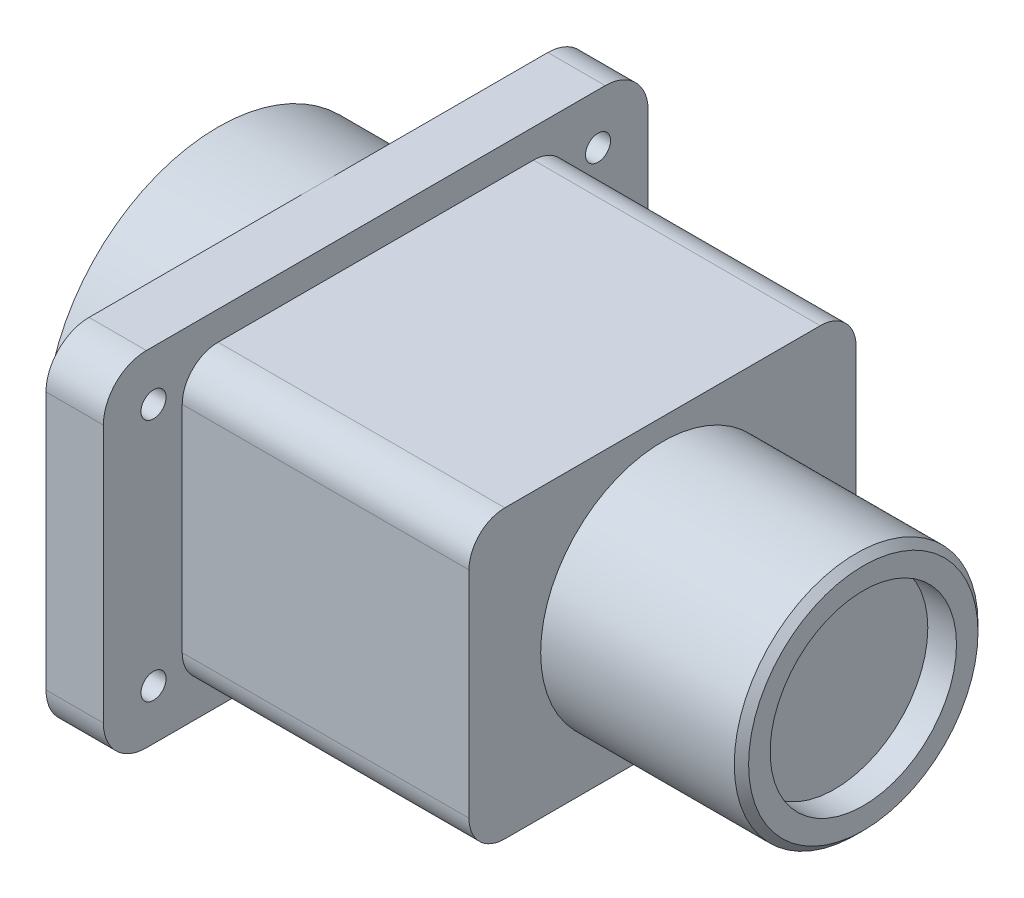
from build123d import *

# Parameters (mm, degrees)
ESQUISSE1_R             = 24
BOSS_EXTRU_1_DEPTH      = 14
BOSS_EXTRU_2_DEPTH      = 8
ESQUISSE3_R             = 1.75
ENL_V_MAT_EXTRU_1_DEPTH = 8
BOSS_EXTRU_3_DEPTH      = 40
ESQUISSE5_R             = 17
BOSS_EXTRU_4_DEPTH      = 28
ESQUISSE6_R             = 13
ENL_V_MAT_EXTRU_2_DEPTH = 4
CHANFREIN1_SIZE         = 1


with BuildPart() as part:
    # Esquisse1 → Boss.-Extru.1 (new body)
    with BuildSketch(Plane(origin=(0, 0, 0), x_dir=(0, 0, -1), z_dir=(1, 0, 0))):
        Circle(ESQUISSE1_R)
    extrude(amount=BOSS_EXTRU_1_DEPTH)

    # Esquisse2 → Boss.-Extru.2 (add)
    with BuildSketch(Plane(origin=(14, 0, 0), x_dir=(0, 0, -1), z_dir=(1, 0, 0))):
        with BuildLine():
            Line((-32, -24), (32, -24))
            ThreePointArc((32, -24), (36.242640687, -22.242640687), (38, -18))
            Line((38, -18), (38, 18))
            ThreePointArc((38, 18), (36.242640687, 22.242640687), (32, 24))
            Line((32, 24), (-32, 24))
            ThreePointArc((-32, 24), (-36.242640687, 22.242640687), (-38, 18))
            Line((-38, 18), (-38, -18))
            ThreePointArc((-38, -18), (-36.242640687, -22.242640687), (-32, -24))
        make_face()
    extrude(amount=BOSS_EXTRU_2_DEPTH)

    # Esquisse3 → Enlèv. mat.-Extru.1 (cut)
    with BuildSketch(Plane(origin=(22, 0, 0), x_dir=(0, 0, -1), z_dir=(1, 0, 0))):
        with Locations((31, 17)):
            Circle(ESQUISSE3_R)
        with Locations((-31, 17)):
            Circle(ESQUISSE3_R)
        with Locations((-31, -17)):
            Circle(ESQUISSE3_R)
        with Locations((31, -17)):
            Circle(ESQUISSE3_R)
    extrude(amount=-ENL_V_MAT_EXTRU_1_DEPTH, mode=Mode.SUBTRACT)

    # Esquisse4 → Boss.-Extru.3 (add)
    with BuildSketch(Plane(origin=(22, 0, 0), x_dir=(0, 0, -1), z_dir=(1, 0, 0))):
        with BuildLine():
            Line((-22, -20), (22, -20))
            ThreePointArc((22, -20), (25.535533906, -18.535533906), (27, -15))
            Line((27, -15), (27, 15))
            ThreePointArc((27, 15), (25.535533906, 18.535533906), (22, 20))
            Line((22, 20), (-22, 20))
            ThreePointArc((-22, 20), (-25.535533906, 18.535533906), (-27, 15))
            Line((-27, 15), (-27, -15))
            ThreePointArc((-27, -15), (-25.535533906, -18.535533906), (-22, -20))
        make_face()
    extrude(amount=BOSS_EXTRU_3_DEPTH)

    # Esquisse5 → Boss.-Extru.4 (add)
    with BuildSketch(Plane(origin=(62, 0, 0), x_dir=(0, 0, -1), z_dir=(1, 0, 0))):
        Circle(ESQUISSE5_R)
    extrude(amount=BOSS_EXTRU_4_DEPTH)

    # Esquisse6 → Enlèv. mat.-Extru.2 (cut)
    with BuildSketch(Plane(origin=(90, 0, 0), x_dir=(0, 0, -1), z_dir=(1, 0, 0))):
        Circle(ESQUISSE6_R)
    extrude(amount=-ENL_V_MAT_EXTRU_2_DEPTH, mode=Mode.SUBTRACT)

    # Chanfrein1
    chanfrein1_edges = [part.edges().sort_by_distance(p)[0] for p in [
        (90, 0, 17),
    ]]
    chamfer(chanfrein1_edges, length=CHANFREIN1_SIZE)


solid = part.part
